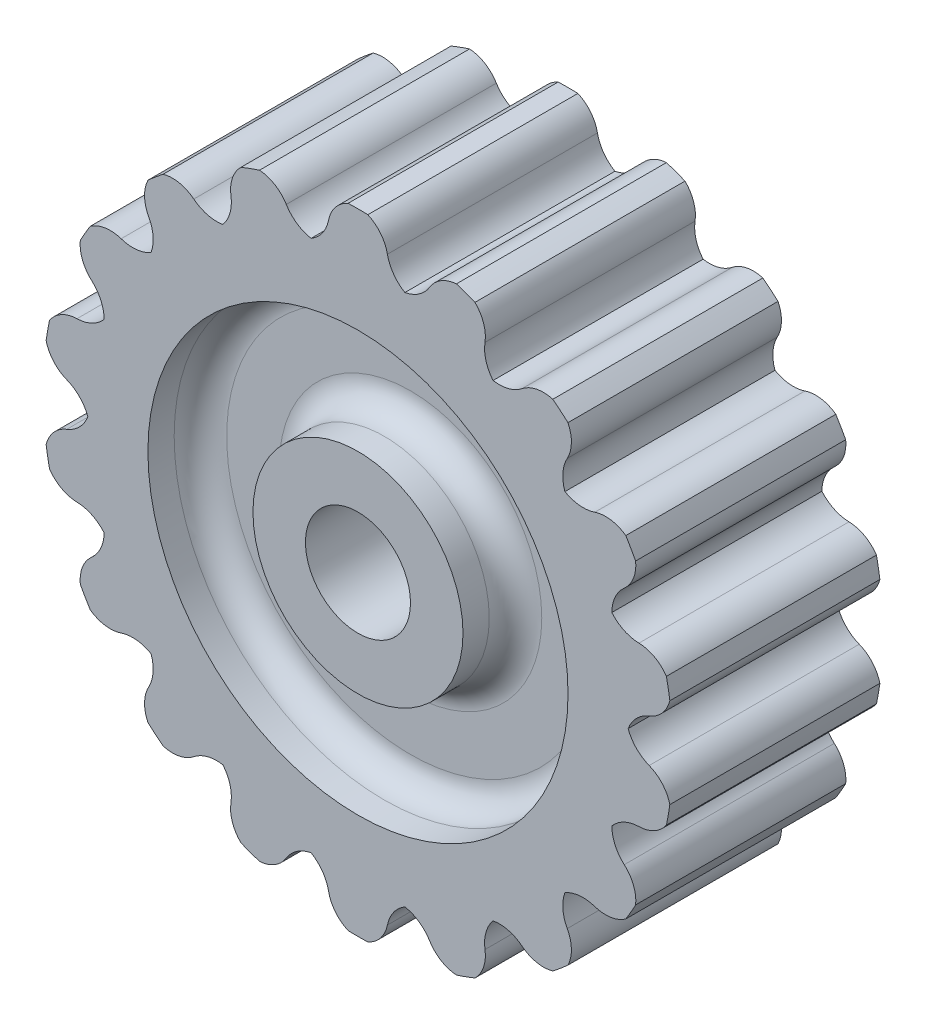
from build123d import *

# Parameters (mm, degrees)
CUT_EXTRUDE4_DEPTH      = 60.56828015
CUT_EXTRUDE4_DEPTH_BACK = 60.56828015


with BuildPart() as part:
    # Sketch1 → Revolve1 (revolve)
    with BuildSketch(Plane(origin=(0, 0, 0), x_dir=(0, 0, -1), z_dir=(1, 0, 0)), mode=Mode.PRIVATE) as revolve1_sk:
        with BuildLine():
            ThreePointArc((9.525, 25.4), (7.27993597, 24.47006403), (6.35, 22.225))
            Line((6.35, 22.225), (6.35, 15.875))
            ThreePointArc((6.35, 15.875), (7.27993597, 13.62993597), (9.525, 12.7))
            Line((9.525, 12.7), (12.7, 12.7))
            Line((12.7, 12.7), (12.7, 6.35))
            Line((12.7, 6.35), (-12.7, 6.35))
            Line((-12.7, 6.35), (-12.7, 12.7))
            Line((-12.7, 12.7), (-9.525, 12.7))
            ThreePointArc((-9.525, 12.7), (-7.27993597, 13.62993597), (-6.35, 15.875))
            Line((-6.35, 15.875), (-6.35, 22.225))
            ThreePointArc((-6.35, 22.225), (-7.27993597, 24.47006403), (-9.525, 25.4))
            Line((-9.525, 25.4), (-12.7, 25.4))
            Line((-12.7, 25.4), (-12.7, 38.1))
            Line((-12.7, 38.1), (12.7, 38.1))
            Line((12.7, 38.1), (12.7, 25.4))
            Line((12.7, 25.4), (9.525, 25.4))
        make_face()
    revolve(revolve1_sk.sketch.rotate(Axis((0, 0, 45.501840491), (0, 0, -1)), 90), axis=Axis((0, 0, 45.501840491), (0, 0, -1)))

    # Sketch2 → Cut-Extrude4 (cut, two sides: drawn at the far end of the back side and taken through both)
    with BuildSketch(Plane.XY.offset(12.7).offset(-CUT_EXTRUDE4_DEPTH_BACK)):
        with BuildLine():
            ThreePointArc((35.210604435, 2.593640551), (33.661156199, 1.568112092), (32.6644, 0))
            ThreePointArc((32.6644, 0), (33.661156199, -1.568112092), (35.210604435, -2.593640551))
            ThreePointArc((35.210604435, -2.593640551), (36.804464445, -3.712859333), (37.710053333, -5.437083557))
            ThreePointArc((37.710053333, -5.437083557), (38.1, 0), (37.710053333, 5.437083557))
            ThreePointArc((37.710053333, 5.437083557), (36.804464445, 3.712859333), (35.210604435, 2.593640551))
        make_face()
        with BuildLine():
            ThreePointArc((32.200067848, 14.479960862), (31.094814165, 12.98633683), (30.694495642, 11.17188277))
            ThreePointArc((30.694495642, 11.17188277), (32.16746601, 10.039250106), (33.974222474, 9.605511089))
            ThreePointArc((33.974222474, 9.605511089), (35.854756332, 9.098921688), (37.295450944, 7.788410548))
            ThreePointArc((37.295450944, 7.788410548), (35.802288852, 13.030967461), (33.576266749, 18.006785143))
            ThreePointArc((33.576266749, 18.006785143), (33.31501097, 16.076814721), (32.200067848, 14.479960862))
        make_face()
        with BuildLine():
            ThreePointArc((33.974222474, -9.605511089), (32.16746601, -10.039250106), (30.694495642, -11.17188277))
            ThreePointArc((30.694495642, -11.17188277), (31.094814165, -12.98633683), (32.200067848, -14.479960862))
            ThreePointArc((32.200067848, -14.479960862), (33.31501097, -16.076814721), (33.576266749, -18.006785143))
            ThreePointArc((33.576266749, -18.006785143), (35.802288852, -13.030967461), (37.295450944, -7.788410548))
            ThreePointArc((37.295450944, -7.788410548), (35.854756332, -9.098921688), (33.974222474, -9.605511089))
        make_face()
        with BuildLine():
            ThreePointArc((25.305727856, 24.619784192), (24.777978632, 22.838217687), (25.022382108, 20.996271598))
            ThreePointArc((25.022382108, 20.996271598), (26.793904679, 20.435730578), (28.640047877, 20.646096329))
            ThreePointArc((28.640047877, 20.646096329), (30.580435445, 20.813238467), (32.382466749, 20.074507397))
            ThreePointArc((32.382466749, 20.074507397), (29.186293283, 24.490207929), (25.392686862, 28.404602689))
            ThreePointArc((25.392686862, 28.404602689), (25.807275495, 26.501668986), (25.305727856, 24.619784192))
        make_face()
        with BuildLine():
            ThreePointArc((28.640047877, -20.646096329), (26.793904679, -20.435730578), (25.022382108, -20.996271598))
            ThreePointArc((25.022382108, -20.996271598), (24.777978632, -22.838217687), (25.305727856, -24.619784192))
            ThreePointArc((25.305727856, -24.619784192), (25.807275495, -26.501668986), (25.392686862, -28.404602689))
            ThreePointArc((25.392686862, -28.404602689), (29.186293283, -24.490207929), (32.382466749, -20.074507397))
            ThreePointArc((32.382466749, -20.074507397), (30.580435445, -20.813238467), (28.640047877, -20.646096329))
        make_face()
        with BuildLine():
            ThreePointArc((15.359143612, 31.790098199), (15.472553192, 29.935472436), (16.3322, 28.288200199))
            ThreePointArc((16.3322, 28.288200199), (18.188603008, 28.367360343), (19.851460823, 29.196457648))
            ThreePointArc((19.851460823, 29.196457648), (21.617662725, 30.017171516), (23.56367915, 29.939322386))
            ThreePointArc((23.56367915, 29.939322386), (19.05, 32.995567884), (14.146374183, 35.376405943))
            ThreePointArc((14.146374183, 35.376405943), (15.18680172, 33.730030848), (15.359143612, 31.790098199))
        make_face()
        with BuildLine():
            ThreePointArc((19.851460823, -29.196457648), (18.188603008, -28.367360343), (16.3322, -28.288200199))
            ThreePointArc((16.3322, -28.288200199), (15.472553192, -29.935472436), (15.359143612, -31.790098199))
            ThreePointArc((15.359143612, -31.790098199), (15.18680172, -33.730030848), (14.146374183, -35.376405943))
            ThreePointArc((14.146374183, -35.376405943), (19.05, -32.995567884), (23.56367915, -29.939322386))
            ThreePointArc((23.56367915, -29.939322386), (21.617662725, -30.017171516), (19.851460823, -29.196457648))
        make_face()
        with BuildLine():
            ThreePointArc((3.560019972, 35.126057191), (4.300909486, 33.422067408), (5.672113535, 32.168154367))
            ThreePointArc((5.672113535, 32.168154367), (7.389487378, 32.877467793), (8.668494618, 34.225295281))
            ThreePointArc((8.668494618, 34.225295281), (10.047480837, 35.600590674), (11.902764082, 36.193013237))
            ThreePointArc((11.902764082, 36.193013237), (6.615995569, 37.52117539), (1.1938, 38.081292541))
            ThreePointArc((1.1938, 38.081292541), (2.734575524, 36.890053188), (3.560019972, 35.126057191))
        make_face()
        with BuildLine():
            ThreePointArc((8.668494618, -34.225295281), (7.389487378, -32.877467793), (5.672113535, -32.168154367))
            ThreePointArc((5.672113535, -32.168154367), (4.300909486, -33.422067408), (3.560019972, -35.126057191))
            ThreePointArc((3.560019972, -35.126057191), (2.734575524, -36.890053188), (1.1938, -38.081292541))
            ThreePointArc((1.1938, -38.081292541), (6.615995569, -37.52117539), (11.902764082, -36.193013237))
            ThreePointArc((11.902764082, -36.193013237), (10.047480837, -35.600590674), (8.668494618, -34.225295281))
        make_face()
        with BuildLine():
            ThreePointArc((-8.668494618, 34.225295281), (-7.389487378, 32.877467793), (-5.672113535, 32.168154367))
            ThreePointArc((-5.672113535, 32.168154367), (-4.300909486, 33.422067408), (-3.560019972, 35.126057191))
            ThreePointArc((-3.560019972, 35.126057191), (-2.734575524, 36.890053188), (-1.1938, 38.081292541))
            ThreePointArc((-1.1938, 38.081292541), (-6.615995569, 37.52117539), (-11.902764082, 36.193013237))
            ThreePointArc((-11.902764082, 36.193013237), (-10.047480837, 35.600590674), (-8.668494618, 34.225295281))
        make_face()
        with BuildLine():
            ThreePointArc((-3.560019972, -35.126057191), (-4.300909486, -33.422067408), (-5.672113535, -32.168154367))
            ThreePointArc((-5.672113535, -32.168154367), (-7.389487378, -32.877467793), (-8.668494618, -34.225295281))
            ThreePointArc((-8.668494618, -34.225295281), (-10.047480837, -35.600590674), (-11.902764082, -36.193013237))
            ThreePointArc((-11.902764082, -36.193013237), (-6.615995569, -37.52117539), (-1.1938, -38.081292541))
            ThreePointArc((-1.1938, -38.081292541), (-2.734575524, -36.890053188), (-3.560019972, -35.126057191))
        make_face()
        with BuildLine():
            ThreePointArc((-19.851460823, 29.196457648), (-18.188603008, 28.367360343), (-16.3322, 28.288200199))
            ThreePointArc((-16.3322, 28.288200199), (-15.472553192, 29.935472436), (-15.359143612, 31.790098199))
            ThreePointArc((-15.359143612, 31.790098199), (-15.18680172, 33.730030848), (-14.146374183, 35.376405943))
            ThreePointArc((-14.146374183, 35.376405943), (-19.05, 32.995567884), (-23.56367915, 29.939322386))
            ThreePointArc((-23.56367915, 29.939322386), (-21.617662725, 30.017171516), (-19.851460823, 29.196457648))
        make_face()
        with BuildLine():
            ThreePointArc((-15.359143612, -31.790098199), (-15.472553192, -29.935472436), (-16.3322, -28.288200199))
            ThreePointArc((-16.3322, -28.288200199), (-18.188603008, -28.367360343), (-19.851460823, -29.196457648))
            ThreePointArc((-19.851460823, -29.196457648), (-21.617662725, -30.017171516), (-23.56367915, -29.939322386))
            ThreePointArc((-23.56367915, -29.939322386), (-19.05, -32.995567884), (-14.146374183, -35.376405943))
            ThreePointArc((-14.146374183, -35.376405943), (-15.18680172, -33.730030848), (-15.359143612, -31.790098199))
        make_face()
        with BuildLine():
            ThreePointArc((-28.640047877, 20.646096329), (-26.793904679, 20.435730578), (-25.022382108, 20.996271598))
            ThreePointArc((-25.022382108, 20.996271598), (-24.777978632, 22.838217687), (-25.305727856, 24.619784192))
            ThreePointArc((-25.305727856, 24.619784192), (-25.807275495, 26.501668986), (-25.392686862, 28.404602689))
            ThreePointArc((-25.392686862, 28.404602689), (-29.186293283, 24.490207929), (-32.382466749, 20.074507397))
            ThreePointArc((-32.382466749, 20.074507397), (-30.580435445, 20.813238467), (-28.640047877, 20.646096329))
        make_face()
        with BuildLine():
            ThreePointArc((-25.305727856, -24.619784192), (-24.777978632, -22.838217687), (-25.022382108, -20.996271598))
            ThreePointArc((-25.022382108, -20.996271598), (-26.793904679, -20.435730578), (-28.640047877, -20.646096329))
            ThreePointArc((-28.640047877, -20.646096329), (-30.580435445, -20.813238467), (-32.382466749, -20.074507397))
            ThreePointArc((-32.382466749, -20.074507397), (-29.186293283, -24.490207929), (-25.392686862, -28.404602689))
            ThreePointArc((-25.392686862, -28.404602689), (-25.807275495, -26.501668986), (-25.305727856, -24.619784192))
        make_face()
        with BuildLine():
            ThreePointArc((-33.974222474, 9.605511089), (-32.16746601, 10.039250106), (-30.694495642, 11.17188277))
            ThreePointArc((-30.694495642, 11.17188277), (-31.094814165, 12.98633683), (-32.200067848, 14.479960862))
            ThreePointArc((-32.200067848, 14.479960862), (-33.31501097, 16.076814721), (-33.576266749, 18.006785143))
            ThreePointArc((-33.576266749, 18.006785143), (-35.802288852, 13.030967461), (-37.295450944, 7.788410548))
            ThreePointArc((-37.295450944, 7.788410548), (-35.854756332, 9.098921688), (-33.974222474, 9.605511089))
        make_face()
        with BuildLine():
            ThreePointArc((-32.200067848, -14.479960862), (-31.094814165, -12.98633683), (-30.694495642, -11.17188277))
            ThreePointArc((-30.694495642, -11.17188277), (-32.16746601, -10.039250106), (-33.974222474, -9.605511089))
            ThreePointArc((-33.974222474, -9.605511089), (-35.854756332, -9.098921688), (-37.295450944, -7.788410548))
            ThreePointArc((-37.295450944, -7.788410548), (-35.802288852, -13.030967461), (-33.576266749, -18.006785143))
            ThreePointArc((-33.576266749, -18.006785143), (-33.31501097, -16.076814721), (-32.200067848, -14.479960862))
        make_face()
        with BuildLine():
            ThreePointArc((-35.210604435, -2.593640551), (-33.661156199, -1.568112092), (-32.6644, 0))
            ThreePointArc((-32.6644, 0), (-33.661156199, 1.568112092), (-35.210604435, 2.593640551))
            ThreePointArc((-35.210604435, 2.593640551), (-36.804464445, 3.712859333), (-37.710053333, 5.437083557))
            ThreePointArc((-37.710053333, 5.437083557), (-38.1, 0), (-37.710053333, -5.437083557))
            ThreePointArc((-37.710053333, -5.437083557), (-36.804464445, -3.712859333), (-35.210604435, -2.593640551))
        make_face()
    extrude(amount=CUT_EXTRUDE4_DEPTH + CUT_EXTRUDE4_DEPTH_BACK, mode=Mode.SUBTRACT)


solid = part.part
